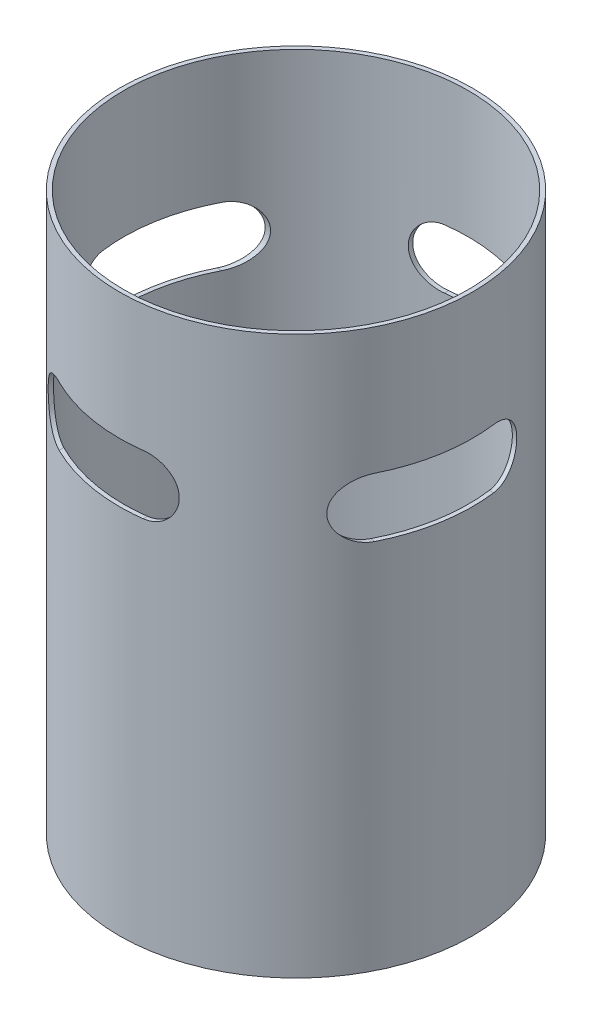
from build123d import *

# Parameters (mm, degrees)
SKETCH2_R           = 20.9
SKETCH2_R_2         = 20.4
BOSS_EXTRUDE1_DEPTH = 66
SKETCH3_R           = 20.848686735
BOSS_EXTRUDE2_DEPTH = 0.1
SKETCH4_R           = 8.6
BOSS_EXTRUDE3_DEPTH = 3.5
SKETCH5_R           = 2.4
BOSS_EXTRUDE4_DEPTH = 1.35
SKETCH7_R           = 2.4
CUT_EXTRUDE1_DEPTH  = 76.523969705
CUT_EXTRUDE6_DEPTH  = 73.316111621
CIRPATTERN2_COUNT   = 4


with BuildPart() as part:
    # Sketch2 → Boss-Extrude1 (new body)
    with BuildSketch(Plane(origin=(0, 0, 0), x_dir=(1, 0, 0), z_dir=(0, 1, 0))):
        with Locations(Location((0, 0, 0), (0, 0, 270))):
            Circle(SKETCH2_R)
        with Locations(Location((0, 0, 0), (0, 0, 270))):
            Circle(SKETCH2_R_2, mode=Mode.SUBTRACT)
    extrude(amount=BOSS_EXTRUDE1_DEPTH)

    # Sketch3 → Boss-Extrude2 (add)
    with BuildSketch(Plane(origin=(0, 0, 0), x_dir=(1, 0, 0), z_dir=(0, 1, 0))):
        Circle(SKETCH3_R)
    extrude(amount=BOSS_EXTRUDE2_DEPTH)

    # Sketch4 → Boss-Extrude3 (add)
    with BuildSketch(Plane(origin=(0, 0, 0), x_dir=(1, 0, 0), z_dir=(0, 1, 0))):
        with Locations(Location((0.271248052, 0, 0), (0, 0, 270))):
            Circle(SKETCH4_R)
    extrude(amount=-BOSS_EXTRUDE3_DEPTH)

    # Sketch5 → Boss-Extrude4 (add)
    with BuildSketch(Plane.XZ.offset(3.5)):
        with Locations((0.36166407, 0)):
            Circle(SKETCH5_R)
    extrude(amount=-BOSS_EXTRUDE4_DEPTH)

    # Sketch7 → Cut-Extrude1 (cut, through all)
    with BuildSketch(Plane.XZ.offset(3.5)):
        with Locations(Location((0.271248052, 0, 0), (0, 0, 270))):
            Circle(SKETCH7_R)
    extrude(amount=-CUT_EXTRUDE1_DEPTH, mode=Mode.SUBTRACT)

    # Sketch15 → Cut-Extrude6 (cut, through all)
    with BuildSketch(Plane(origin=(0, 0, 0), x_dir=(0, 0, -1), z_dir=(1, 0, 0))):
        with BuildLine():
            Line((-2.657246102, 51), (9.342753898, 51))
            ThreePointArc((9.342753898, 51), (12.842753898, 47.5), (9.342753898, 44))
            Line((9.342753898, 44), (-2.657246102, 44))
            ThreePointArc((-2.657246102, 44), (-6.157246102, 47.5), (-2.657246102, 51))
        make_face()
    cut_extrude6 = extrude(amount=-CUT_EXTRUDE6_DEPTH, mode=Mode.SUBTRACT)

    # CirPattern2: Cut-Extrude6 ×4 about axis
    cirpattern2_axis = Axis((0, 66, 0), (0, -1, 0))
    for i in range(1, CIRPATTERN2_COUNT):
        add(cut_extrude6.rotate(cirpattern2_axis, i * 360 / CIRPATTERN2_COUNT), mode=Mode.SUBTRACT)


solid = part.part
